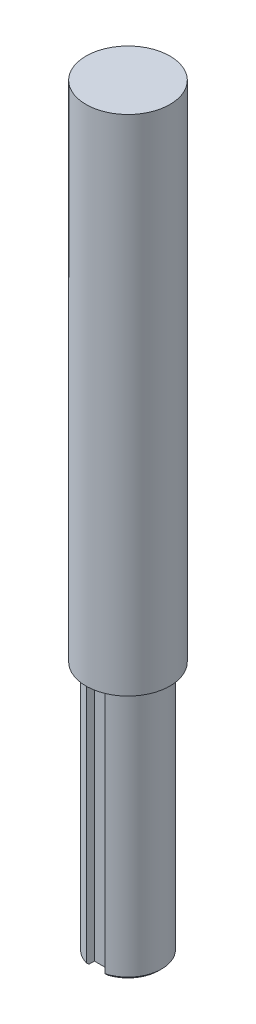
from build123d import *

# Parameters (mm, degrees)
CHAMFER1_SIZE      = 0.3
SKETCH2_W          = 2.25
SKETCH2_H          = 2.25
CUT_EXTRUDE1_DEPTH = 30


with BuildPart() as part:
    # Sketch1 → Revolve1 (revolve)
    with BuildSketch(Plane.XY, mode=Mode.PRIVATE) as revolve1_sk:
        Polygon((0, 0), (4, 0), (4, 30), (5, 30), (5, 90), (0, 90), align=None)
    revolve(revolve1_sk.sketch.rotate(Axis((0, 90, 0), (0, -1, 0)), 180), axis=Axis((0, 90, 0), (0, -1, 0)))

    # Chamfer1
    chamfer1_edges = [part.edges().sort_by_distance(p)[0] for p in [
        (4, 0, 0),
    ]]
    chamfer(chamfer1_edges, length=CHAMFER1_SIZE)

    # Sketch2 → Cut-Extrude1 (cut)
    with BuildSketch(Plane.XZ):
        with Locations((0, 4)):
            Rectangle(SKETCH2_W, SKETCH2_H)
    extrude(amount=-CUT_EXTRUDE1_DEPTH, mode=Mode.SUBTRACT)


solid = part.part
